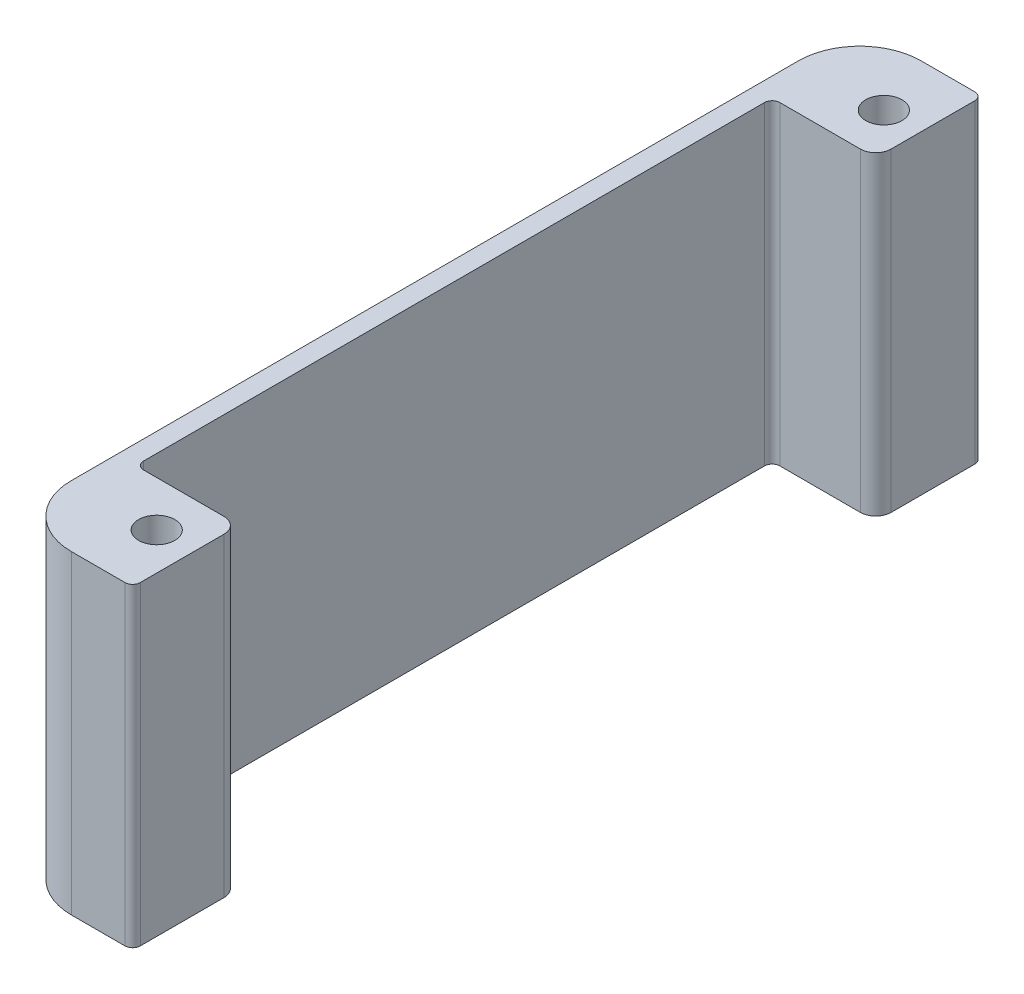
from build123d import *

# Parameters (mm, degrees)
BOSS_EXTRUDE1_DEPTH  = 52.09999994
BOSS_EXTRUDE2_START  = -52.09999994
SKETCH2_R            = 3
BOSS_EXTRUDE2_DEPTH  = 52.09999994
FILLET1_R            = 2.54
FILLET2_R            = 1.27
FILLET2_OF_MIRROR1_R = 1.27
FILLET3_R            = 1.27
FILLET4_R            = 2.54


with BuildPart() as part:
    # Sketch1 → Boss-Extrude1 (new body)
    with BuildSketch(Plane(origin=(0, 0, 0), x_dir=(1, 0, 0), z_dir=(0, 1, 0))):
        with BuildLine():
            Line((0, 120.3706), (0, 0))
            Line((0, 0), (3.175, 0))
            Line((3.175, 0), (3.175, 120.3706))
            ThreePointArc((3.175, 120.3706), (5.220859133, 125.309740867), (10.16, 127.3556))
            Line((10.16, 127.3556), (20.32, 127.3556))
            Line((20.32, 127.3556), (20.32, 130.5306))
            Line((20.32, 130.5306), (10.16, 130.5306))
            ThreePointArc((10.16, 130.5306), (2.975795103, 127.554804897), (0, 120.3706))
        make_face()
        with BuildLine():
            Line((3.175, 0), (0, 0))
            ThreePointArc((0, 0), (2.975795103, -7.184204897), (10.16, -10.16))
            Line((10.16, -10.16), (20.32, -10.16))
            Line((20.32, -10.16), (20.32, -6.985))
            Line((20.32, -6.985), (10.16, -6.985))
            ThreePointArc((10.16, -6.985), (5.220859133, -4.939140867), (3.175, 0))
        make_face()
    extrude(amount=BOSS_EXTRUDE1_DEPTH)

    # Sketch2 → Boss-Extrude2 (add)
    with BuildSketch(Plane(origin=(0, 52.09999994, 0), x_dir=(1, 0, 0), z_dir=(0, 1, 0)).offset(BOSS_EXTRUDE2_START)):
        with BuildLine():
            Line((3.175, 112.856959641), (10.16, 112.856959641))
            Line((10.16, 112.856959641), (20.32, 112.856959641))
            Line((20.32, 112.856959641), (20.32, 127.3556))
            Line((20.32, 127.3556), (10.16, 127.3556))
            ThreePointArc((10.16, 127.3556), (5.220859133, 125.309740867), (3.175, 120.3706))
            Line((3.175, 120.3706), (3.175, 112.856959641))
        make_face()
        with Locations(Location((14.1478, 120.3706, 0), (0, 0, 270))):
            Circle(SKETCH2_R, mode=Mode.SUBTRACT)
    boss_extrude2 = extrude(amount=BOSS_EXTRUDE2_DEPTH)

    # Fillet1
    fillet1_edges = [part.edges().sort_by_distance(p)[0] for p in [
        (20.32, 26.04999997, -112.856959641),
    ]]
    fillet(fillet1_edges, radius=FILLET1_R)

    # Fillet2
    fillet2_edges = [part.edges().sort_by_distance(p)[0] for p in [
        (3.175, 26.04999997, -112.856959641),
    ]]
    fillet(fillet2_edges, radius=FILLET2_R)

    # Mirror1: Boss-Extrude2 across plane
    add(boss_extrude2.mirror(Plane(origin=(0, 0, -60.1853), x_dir=(1, 0, 0), z_dir=(0, 0, -1))))

    # Fillet2 of Mirror1
    fillet2_of_mirror1_edges = [part.edges().sort_by_distance(p)[0] for p in [
        (3.175, 26.04999997, -7.513640359),
    ]]
    fillet(fillet2_of_mirror1_edges, radius=FILLET2_OF_MIRROR1_R)

    # Fillet3
    fillet3_edges = [part.edges().sort_by_distance(p)[0] for p in [
        (20.32, 26.04999997, 10.16),
        (20.32, 26.04999997, -130.5306),
    ]]
    fillet(fillet3_edges, radius=FILLET3_R)

    # Fillet4
    fillet4_edges = [part.edges().sort_by_distance(p)[0] for p in [
        (20.32, 26.04999997, -7.513640359),
    ]]
    fillet(fillet4_edges, radius=FILLET4_R)


solid = part.part
